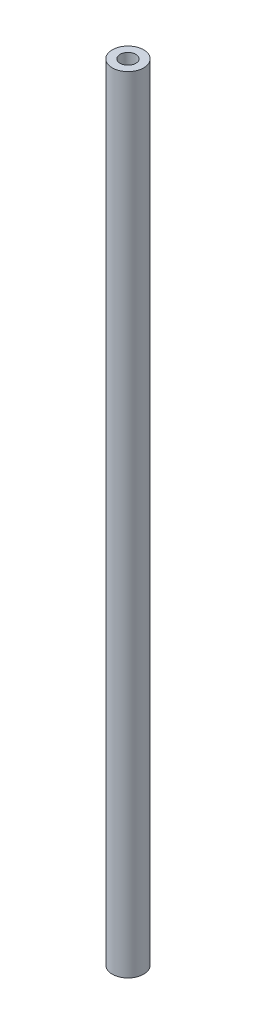
from build123d import *

# Parameters (mm, degrees)
CROQUIS1_R              = 4
CROQUIS1_R_2            = 2
SALIENTE_EXTRUIR1_DEPTH = 200


with BuildPart() as part:
    # Croquis1 → Saliente-Extruir1 (new body)
    with BuildSketch(Plane(origin=(0, 0, 0), x_dir=(1, 0, 0), z_dir=(0, 1, 0))):
        with Locations(Location((0, 0, 0), (0, 0, 270))):
            Circle(CROQUIS1_R)
        with Locations(Location((0, 0, 0), (0, 0, 270))):
            Circle(CROQUIS1_R_2, mode=Mode.SUBTRACT)
    extrude(amount=SALIENTE_EXTRUIR1_DEPTH)


solid = part.part
